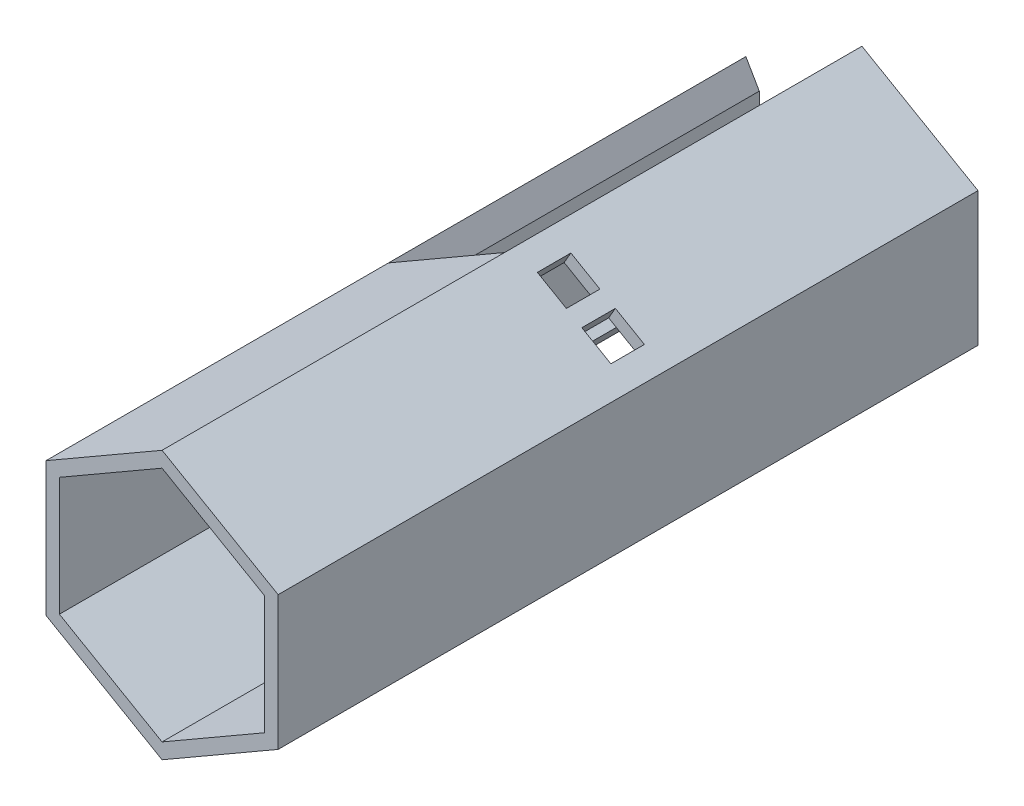
from build123d import *

# Parameters (mm, degrees)
BOSS_EXTRUDE2_DEPTH = 940
CUT_EXTRUDE3_REACH  = 1020.577
SKETCH4_W           = 45
SKETCH4_H           = 45
CUT_EXTRUDE4_REACH  = 1020.577
SKETCH5_W           = 45
SKETCH5_H           = 45
CUT_EXTRUDE6_REACH  = 1020.577
SKETCH7_W           = 180
SKETCH7_H           = 480
SKETCH9_W           = 45
SKETCH9_H           = 45
CUT_EXTRUDE7_DEPTH  = 18


with BuildPart() as part:
    # Sketch1 → Boss-Extrude2 (new body)
    with BuildSketch(Plane.XY):
        Polygon((0, 180), (-155.884572681, 90), (-155.884572681, -90), (0, -180), (155.884572681, -90), (155.884572681, 90), align=None)
        Polygon((-137.884572681, 79.607695155), (-137.884572681, -79.607695155), (0, -159.215390309), (137.884572681, -79.607695155), (137.884572681, 79.607695155), (0, 159.215390309), align=None, mode=Mode.SUBTRACT)
    extrude(amount=BOSS_EXTRUDE2_DEPTH)

    # Sketch4 → Cut-Extrude3 (cut, up to next)
    with BuildSketch(Plane(origin=(77.942286341, -135, 0), x_dir=(0.8660254037844388, 0.4999999999999997, 0), z_dir=(0.4999999999999997, -0.8660254037844388, 0)), mode=Mode.PRIVATE) as cut_extrude3_sk1:
        with Locations((0, 442)):
            Rectangle(SKETCH4_W, SKETCH4_H)
    cut_extrude3_tool1 = extrude(cut_extrude3_sk1.sketch, amount=-CUT_EXTRUDE3_REACH, mode=Mode.PRIVATE) & part.part
    add(cut_extrude3_tool1.solids().sort_by_distance((77.942286, -135, 442))[0], mode=Mode.SUBTRACT)

    # Sketch5 → Cut-Extrude4 (cut, up to next)
    with BuildSketch(Plane(origin=(-77.942286341, -135, 0), x_dir=(0.8660254037844386, -0.5000000000000001, 0), z_dir=(-0.5000000000000001, -0.8660254037844386, 0)), mode=Mode.PRIVATE) as cut_extrude4_sk1:
        with Locations((34.5, 442)):
            Rectangle(SKETCH5_W, SKETCH5_H)
    cut_extrude4_tool1 = extrude(cut_extrude4_sk1.sketch, amount=-CUT_EXTRUDE4_REACH, mode=Mode.PRIVATE) & part.part
    # Sketch5 → Cut-Extrude4 (cut, up to next)
    with BuildSketch(Plane(origin=(-77.942286341, -135, 0), x_dir=(0.8660254037844386, -0.5000000000000001, 0), z_dir=(-0.5000000000000001, -0.8660254037844386, 0)), mode=Mode.PRIVATE) as cut_extrude4_sk2:
        with Locations((-34.5, 442)):
            Rectangle(SKETCH5_W, SKETCH5_H)
    cut_extrude4_tool2 = extrude(cut_extrude4_sk2.sketch, amount=-CUT_EXTRUDE4_REACH, mode=Mode.PRIVATE) & part.part
    # Sketch5 → Cut-Extrude4 (cut, up to next)
    with BuildSketch(Plane(origin=(-77.942286341, -135, 0), x_dir=(0.8660254037844386, -0.5000000000000001, 0), z_dir=(-0.5000000000000001, -0.8660254037844386, 0)), mode=Mode.PRIVATE) as cut_extrude4_sk3:
        with BuildLine():
            Line((-20, 280), (20, 280))
            ThreePointArc((20, 280), (41.213203436, 271.213203436), (50, 250))
            Line((50, 250), (50, 0))
            Line((50, 0), (-50, 0))
            Line((-50, 0), (-50, 250))
            ThreePointArc((-50, 250), (-41.213203436, 271.213203436), (-20, 280))
        make_face()
    cut_extrude4_tool3 = extrude(cut_extrude4_sk3.sketch, amount=-CUT_EXTRUDE4_REACH, mode=Mode.PRIVATE) & part.part
    add(cut_extrude4_tool1.solids().sort_by_distance((-48.06441, -152.25, 442))[0], mode=Mode.SUBTRACT)
    add(cut_extrude4_tool2.solids().sort_by_distance((-107.820163, -117.75, 442))[0], mode=Mode.SUBTRACT)
    add(cut_extrude4_tool3.solids().sort_by_distance((-77.942286, -135, 138.135305))[0], mode=Mode.SUBTRACT)

    # Sketch7 → Cut-Extrude6 (cut, up to next)
    with BuildSketch(Plane(origin=(-77.942286341, 135, 0), x_dir=(0.8660254037844388, 0.49999999999999983, 0), z_dir=(-0.4999999999999998, 0.8660254037844387, 0)), mode=Mode.PRIVATE) as cut_extrude6_sk1:
        with Locations((0, -240)):
            Rectangle(SKETCH7_W, SKETCH7_H)
    cut_extrude6_tool1 = extrude(cut_extrude6_sk1.sketch, amount=-CUT_EXTRUDE6_REACH, mode=Mode.PRIVATE) & part.part
    add(cut_extrude6_tool1.solids().sort_by_distance((-77.942286, 135, 240))[0], mode=Mode.SUBTRACT)

    # Sketch9 → Cut-Extrude7 (cut)
    with BuildSketch(Plane(origin=(77.942286341, 135, 0), x_dir=(0.8660254037844386, -0.4999999999999999, 0), z_dir=(0.49999999999999994, 0.8660254037844387, 0))):
        with Locations((-34.5, -442)):
            Rectangle(SKETCH9_W, SKETCH9_H)
        with Locations((34.5, -442)):
            Rectangle(SKETCH9_W, SKETCH9_H)
    extrude(amount=-CUT_EXTRUDE7_DEPTH, mode=Mode.SUBTRACT)


solid = part.part
